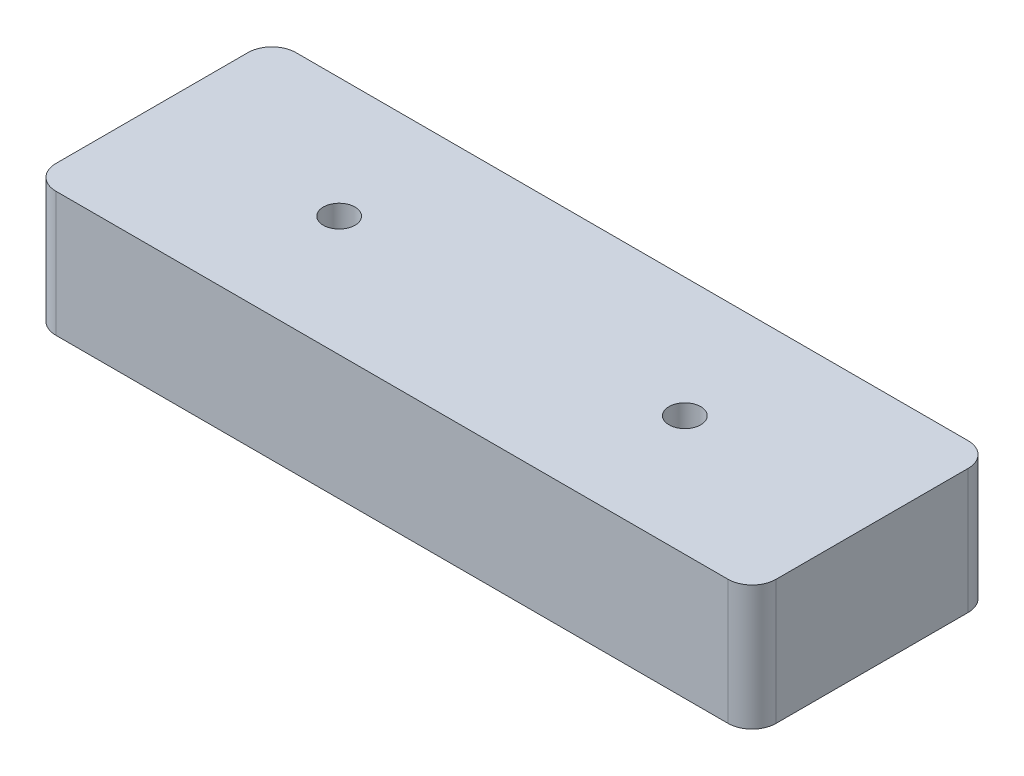
from build123d import *

# Parameters (mm, degrees)
SKETCH1_W                   = 75
SKETCH1_H                   = 25
BOSS_EXTRUDE1_DEPTH         = 13
TAP_DRILL_FOR_M4X0_7_TAP1_D = 3.3
FILLET1_R                   = 2.5


with BuildPart() as part:
    # Sketch1 → Boss-Extrude1 (new body)
    with BuildSketch(Plane(origin=(0, 0, 0), x_dir=(1, 0, 0), z_dir=(0, 1, 0))):
        Rectangle(SKETCH1_W, SKETCH1_H)
    extrude(amount=BOSS_EXTRUDE1_DEPTH)

    # Tap Drill for M4x0.7 Tap1 (through all)
    with Locations(Plane(origin=(0, 13, 0), x_dir=(1, 0, 0), z_dir=(0, 1, 0))):
        with Locations((-18, 0), (18, 0)):
            Hole(TAP_DRILL_FOR_M4X0_7_TAP1_D / 2)

    # Fillet1
    fillet1_edges = [part.edges().sort_by_distance(p)[0] for p in [
        (37.5, 6.5, 12.5),
        (-37.5, 6.5, 12.5),
        (-37.5, 6.5, -12.5),
        (37.5, 6.5, -12.5),
    ]]
    fillet(fillet1_edges, radius=FILLET1_R)


solid = part.part
